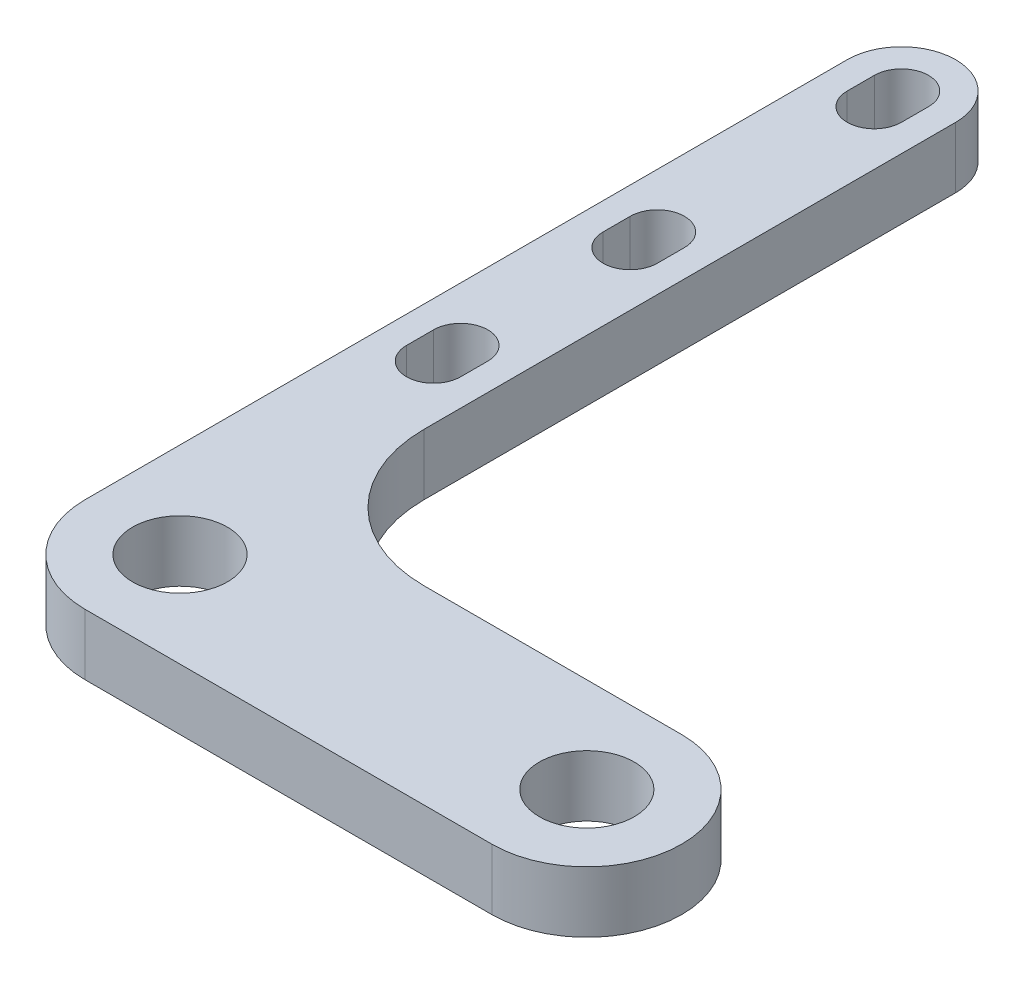
from build123d import *

# Parameters (mm, degrees)
SKETCH1_R           = 3.5
BOSS_EXTRUDE1_DEPTH = 4.5


with BuildPart() as part:
    # Sketch1 → Boss-Extrude1 (new body)
    with BuildSketch(Plane(origin=(0, 0, 0), x_dir=(1, 0, 0), z_dir=(0, 1, 0))):
        with BuildLine():
            Line((11, 7), (30, 7))
            ThreePointArc((30, 7), (37, 0), (30, -7))
            Line((30, -7), (0, -7))
            ThreePointArc((0, -7), (-4.949747468, -4.949747468), (-7, 0))
            Line((-7, 0), (-7, 21.7))
            Line((-7, 21.7), (-7, 56.2))
            ThreePointArc((-7, 56.2), (-3, 60.2), (1, 56.2))
            Line((1, 56.2), (1, 17))
            ThreePointArc((1, 17), (3.928932188, 9.928932188), (11, 7))
        make_face()
        with Locations(Location((0, 0, 0), (0, 0, 270))):
            Circle(SKETCH1_R, mode=Mode.SUBTRACT)
        with Locations(Location((30, 0, 0), (0, 0, 270))):
            Circle(SKETCH1_R, mode=Mode.SUBTRACT)
        with BuildLine():
            Line((-5, 21.7), (-5, 23.7))
            ThreePointArc((-5, 23.7), (-3, 25.7), (-1, 23.7))
            Line((-1, 23.7), (-1, 21.7))
            ThreePointArc((-1, 21.7), (-3, 19.7), (-5, 21.7))
        make_face(mode=Mode.SUBTRACT)
        with BuildLine():
            Line((-5, 36.2), (-5, 38.2))
            ThreePointArc((-5, 38.2), (-3, 40.2), (-1, 38.2))
            Line((-1, 38.2), (-1, 36.2))
            ThreePointArc((-1, 36.2), (-3, 34.2), (-5, 36.2))
        make_face(mode=Mode.SUBTRACT)
        with BuildLine():
            Line((-5, 54.2), (-5, 56.2))
            ThreePointArc((-5, 56.2), (-3, 58.2), (-1, 56.2))
            Line((-1, 56.2), (-1, 54.2))
            ThreePointArc((-1, 54.2), (-3, 52.2), (-5, 54.2))
        make_face(mode=Mode.SUBTRACT)
    extrude(amount=BOSS_EXTRUDE1_DEPTH)


solid = part.part
